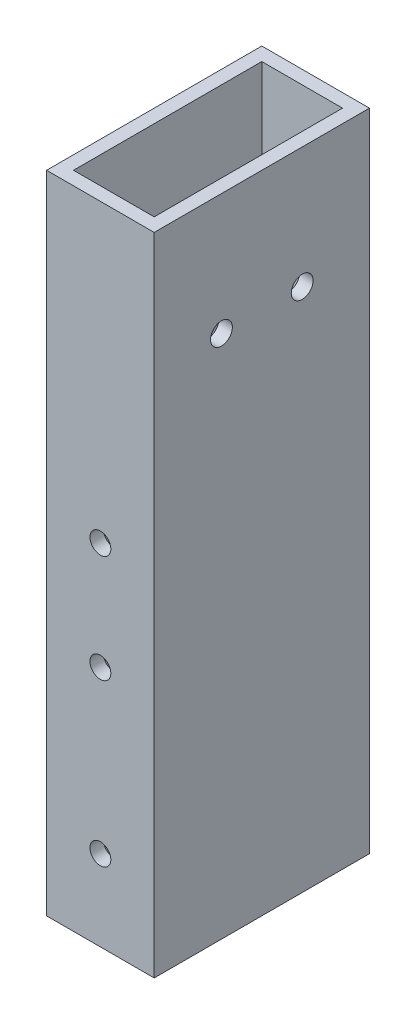
from build123d import *

# Parameters (mm, degrees)
SKETCH1_W                        = 25.4
SKETCH1_H                        = 50.8
SKETCH1_W_2                      = 19.05
SKETCH1_H_2                      = 44.45
BOSS_EXTRUDE1_DEPTH              = 152.4
SKETCH2_R                        = 2.4638
CUT_EXTRUDE1_DEPTH               = 163.639355631
F_13_64_0_20313_DIAMETER_HOLE1_D = 5.159502


with BuildPart() as part:
    # Sketch1 → Boss-Extrude1 (new body)
    with BuildSketch(Plane(origin=(0, 0, 0), x_dir=(1, 0, 0), z_dir=(0, 1, 0))):
        with Locations((12.7, 25.4)):
            Rectangle(SKETCH1_W, SKETCH1_H)
        with Locations((12.7, 25.4)):
            Rectangle(SKETCH1_W_2, SKETCH1_H_2, mode=Mode.SUBTRACT)
    extrude(amount=BOSS_EXTRUDE1_DEPTH)

    # Sketch2 → Cut-Extrude1 (cut, through all)
    with BuildSketch(Plane.XY):
        with Locations((12.7, 82.55)):
            Circle(SKETCH2_R)
        with Locations((12.7, 57.15)):
            Circle(SKETCH2_R)
        with Locations((12.7, 19.05)):
            Circle(SKETCH2_R)
    extrude(amount=-CUT_EXTRUDE1_DEPTH, mode=Mode.SUBTRACT)

    # 13/64 (0.20313) Diameter Hole1 (through all)
    with Locations(Plane.ZY):
        with Locations((-34.925, 123.822021436), (-15.875, 123.822021436)):
            Hole(F_13_64_0_20313_DIAMETER_HOLE1_D / 2)


solid = part.part
